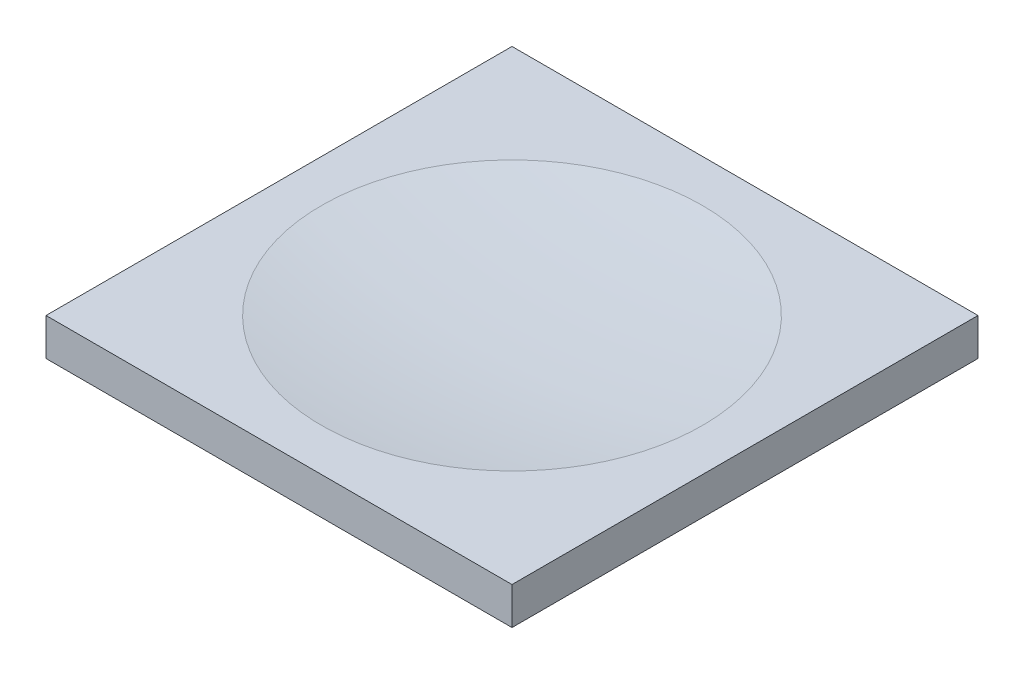
from build123d import *

# Parameters (mm, degrees)
ESQUISSE4_W        = 50
ESQUISSE4_H        = 50
ESQUISSE4_R        = 20.44
BOSS_EXTRU_1_DEPTH = 4


with BuildPart() as part:
    # Esquisse3 → Révolution2 (revolve)
    with BuildSketch(Plane.XY, mode=Mode.PRIVATE) as r_volution2_sk:
        with BuildLine():
            Line((0, 0), (20.44, 0))
            Line((20.44, 0), (20.44, 2.5))
            ThreePointArc((20.44, 2.5), (10.192514587, 2.875465442), (0, 4))
            Line((0, 4), (0, 0))
        make_face()
    revolve(r_volution2_sk.sketch.rotate(Axis((20.44, 0, 0), (0, 1, 0)), 270), axis=Axis((20.44, 0, 0), (0, 1, 0)))

    # Esquisse4 → Boss.-Extru.1 (add)
    with BuildSketch(Plane(origin=(0, 0, 0), x_dir=(-1, 0, 0), z_dir=(0, -1, 0))):
        with Locations((-20.44, 0)):
            Rectangle(ESQUISSE4_W, ESQUISSE4_H)
        with Locations((-20.44, 0)):
            Circle(ESQUISSE4_R, mode=Mode.SUBTRACT)
    extrude(amount=-BOSS_EXTRU_1_DEPTH)


solid = part.part
